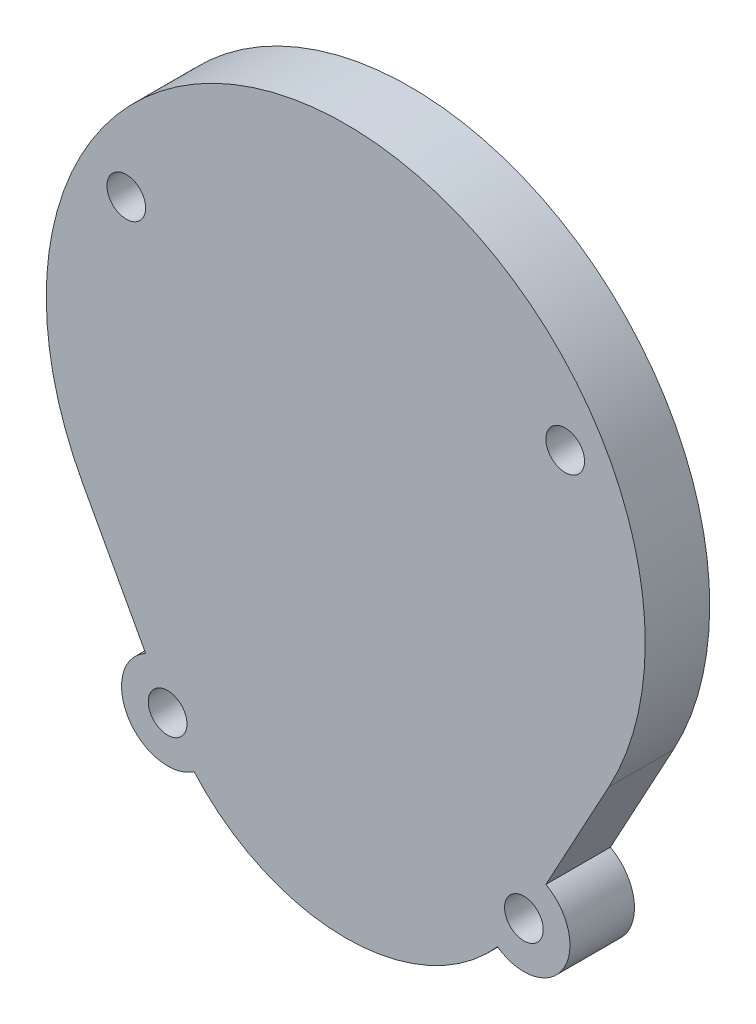
from build123d import *

# Parameters (mm, degrees)
SKETCH1_R           = 2.1
BOSS_EXTRUDE1_DEPTH = 7
BOSS_EXTRUDE2_START = 2
BOSS_EXTRUDE2_DEPTH = 2
SKETCH3_R           = 7.05
CUT_EXTRUDE1_DEPTH  = 5
SKETCH4_R           = 7.5
CUT_EXTRUDE2_DEPTH  = 2


with BuildPart() as part:
    # Sketch1 → Boss-Extrude1 (new body)
    with BuildSketch(Plane.XY):
        with BuildLine():
            Line((-28.559544782, -15.511363636), (-21.718978566, -28.10622388))
            ThreePointArc((-21.718978566, -28.10622388), (-23.583461057, -35.132547662), (-16.46241644, -36.594137349))
            ThreePointArc((-16.46241644, -36.594137349), (0, -44), (16.46241644, -36.594137349))
            ThreePointArc((16.46241644, -36.594137349), (23.583461057, -35.132547662), (21.718978566, -28.10622388))
            Line((21.718978566, -28.10622388), (28.559544782, -15.511363636))
            ThreePointArc((28.559544782, -15.511363636), (0, 32.5), (-28.559544782, -15.511363636))
        make_face()
        with Locations((-23.815698604, 13.75)):
            Circle(SKETCH1_R, mode=Mode.SUBTRACT)
        with Locations((23.815698604, 13.75)):
            Circle(SKETCH1_R, mode=Mode.SUBTRACT)
        with Locations((-19.332614929, -32.5)):
            Circle(SKETCH1_R, mode=Mode.SUBTRACT)
        with Locations((19.332614929, -32.5)):
            Circle(SKETCH1_R, mode=Mode.SUBTRACT)
    extrude(amount=BOSS_EXTRUDE1_DEPTH)

    # Sketch2 → Boss-Extrude2 (add)
    with BuildSketch(Plane(origin=(0, 0, 0), x_dir=(-1, 0, 0), z_dir=(0, 0, -1)).offset(BOSS_EXTRUDE2_START)):
        with BuildLine():
            Line((-23.726391049, -12.886363636), (-14.499461197, -29.875))
            ThreePointArc((-14.499461197, -29.875), (0, -38.5), (14.499461197, -29.875))
            Line((14.499461197, -29.875), (23.726391049, -12.886363636))
            ThreePointArc((23.726391049, -12.886363636), (26.991956985, -0.65898263), (24.326965388, 11.713187226))
            ThreePointArc((24.326965388, 11.713187226), (21.997045256, 12.7), (22.307400391, 15.21117641))
            ThreePointArc((22.307400391, 15.21117641), (0, 27), (-22.307400391, 15.21117641))
            ThreePointArc((-22.307400391, 15.21117641), (-21.997045256, 12.7), (-24.326965388, 11.713187226))
            ThreePointArc((-24.326965388, 11.713187226), (-26.991956985, -0.65898263), (-23.726391049, -12.886363636))
        make_face()
        with BuildLine():
            Line((-21.090125377, -11.454545455), (-11.863195525, -28.443181818))
            ThreePointArc((-11.863195525, -28.443181818), (0, -35.5), (11.863195525, -28.443181818))
            Line((11.863195525, -28.443181818), (21.090125377, -11.454545455))
            ThreePointArc((21.090125377, -11.454545455), (0, 24), (-21.090125377, -11.454545455))
        make_face(mode=Mode.SUBTRACT)
    extrude(amount=-BOSS_EXTRUDE2_DEPTH)

    # Sketch3 → Cut-Extrude1 (cut)
    with BuildSketch(Plane(origin=(0, 0, 0), x_dir=(-1, 0, 0), z_dir=(0, 0, -1))):
        with Locations((0, -22)):
            Circle(SKETCH3_R)
    extrude(amount=-CUT_EXTRUDE1_DEPTH, mode=Mode.SUBTRACT)

    # Sketch4 → Cut-Extrude2 (cut)
    with BuildSketch(Plane(origin=(0, 0, 0), x_dir=(-1, 0, 0), z_dir=(0, 0, -1))):
        Circle(SKETCH4_R)
    extrude(amount=-CUT_EXTRUDE2_DEPTH, mode=Mode.SUBTRACT)


solid = part.part
